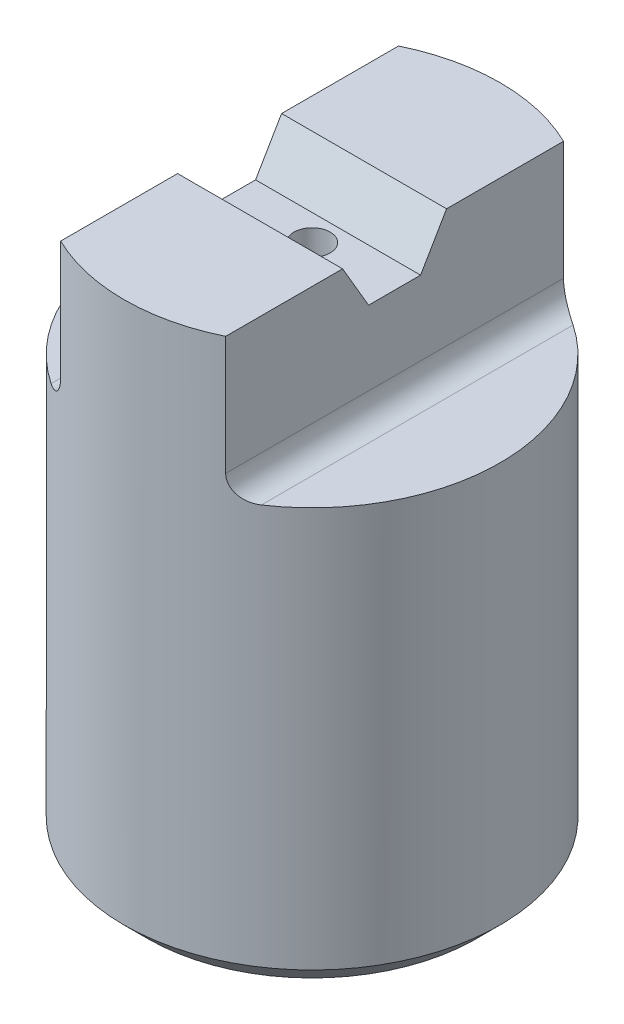
from build123d import *

# Parameters (mm, degrees)
CROQUIS1_R                  = 12.6746
SALIENTE_EXTRUIR1_DEPTH     = 38.1
CORTAR_EXTRUIR1_DEPTH       = 43.105830598
CORTAR_EXTRUIR1_DEPTH_BACK  = 43.105830598
CORTAR_EXTRUIR2_DEPTH       = 43.105830598
CORTAR_EXTRUIR2_DEPTH_BACK  = 43.105830598
CHAFL_N1_SIZE               = 1.5875
CROQUIS4_R                  = 1.2192
CORTAR_EXTRUIR3_DEPTH       = 43.105830748
TALADRO_ROSCADO_8_321_D     = 3.4544
TALADRO_ROSCADO_8_321_DEPTH = 20.574
TALADRO_ROSCADO_8_321_TIP   = 1.037806461


with BuildPart() as part:
    # Croquis1 → Saliente-Extruir1 (new body)
    with BuildSketch(Plane(origin=(0, 0, 0), x_dir=(1, 0, 0), z_dir=(0, 1, 0))):
        with Locations(Location((0, 0, 0), (0, 0, 90))):
            Circle(CROQUIS1_R)
    extrude(amount=SALIENTE_EXTRUIR1_DEPTH)

    # Croquis2 → Cortar-Extruir1 (cut, two sides: drawn at the far end of the back side and taken through both)
    with BuildSketch(Plane(origin=(0, 0, 0), x_dir=(0, 0, -1), z_dir=(1, 0, 0)).offset(-CORTAR_EXTRUIR1_DEPTH_BACK)):
        Polygon((-3.5052, 38.1), (3.5052, 38.1), (1.7526, 35.1028), (-1.7526, 35.1028), align=None)
    extrude(amount=CORTAR_EXTRUIR1_DEPTH + CORTAR_EXTRUIR1_DEPTH_BACK, mode=Mode.SUBTRACT)

    # Croquis3 → Cortar-Extruir2 (cut, two sides: drawn at the far end of the back side and taken through both)
    with BuildSketch(Plane.XY.offset(-CORTAR_EXTRUIR2_DEPTH_BACK)):
        with BuildLine():
            Line((-12.6746, 28.575), (-7.0866, 28.575))
            ThreePointArc((-7.0866, 28.575), (-6.008969265, 29.021369265), (-5.5626, 30.099))
            Line((-5.5626, 30.099), (-5.5626, 38.1))
            Line((-5.5626, 38.1), (-12.6746, 38.1))
            Line((-12.6746, 38.1), (-12.6746, 28.575))
        make_face()
        with BuildLine():
            Line((12.6746, 38.1), (12.6746, 28.575))
            Line((12.6746, 28.575), (7.0866, 28.575))
            ThreePointArc((7.0866, 28.575), (6.008969265, 29.021369265), (5.5626, 30.099))
            Line((5.5626, 30.099), (5.5626, 38.1))
            Line((5.5626, 38.1), (12.6746, 38.1))
        make_face()
    extrude(amount=CORTAR_EXTRUIR2_DEPTH + CORTAR_EXTRUIR2_DEPTH_BACK, mode=Mode.SUBTRACT)

    # Chaflán1
    chafl_n1_edges = [part.edges().sort_by_distance(p)[0] for p in [
        (0, 0, 12.6746),
    ]]
    chamfer(chafl_n1_edges, length=CHAFL_N1_SIZE)

    # Croquis4 → Cortar-Extruir3 (cut, through all)
    with BuildSketch(Plane.XZ):
        with Locations(Location((0, 0, 0), (0, 0, 270))):
            Circle(CROQUIS4_R)
    extrude(amount=-CORTAR_EXTRUIR3_DEPTH, mode=Mode.SUBTRACT)

    # Taladro roscado #8-321
    with Locations(Plane(origin=(0, 0, 0), x_dir=(-1, 0, 0), z_dir=(0, -1, 0))):
        with Locations((0, 0)):
            Hole(TALADRO_ROSCADO_8_321_D / 2, depth=TALADRO_ROSCADO_8_321_DEPTH)
            with Locations((0, 0, -(TALADRO_ROSCADO_8_321_DEPTH + TALADRO_ROSCADO_8_321_TIP / 2))):  # 118° drill point
                Cone(0, TALADRO_ROSCADO_8_321_D / 2, TALADRO_ROSCADO_8_321_TIP, mode=Mode.SUBTRACT)


solid = part.part
